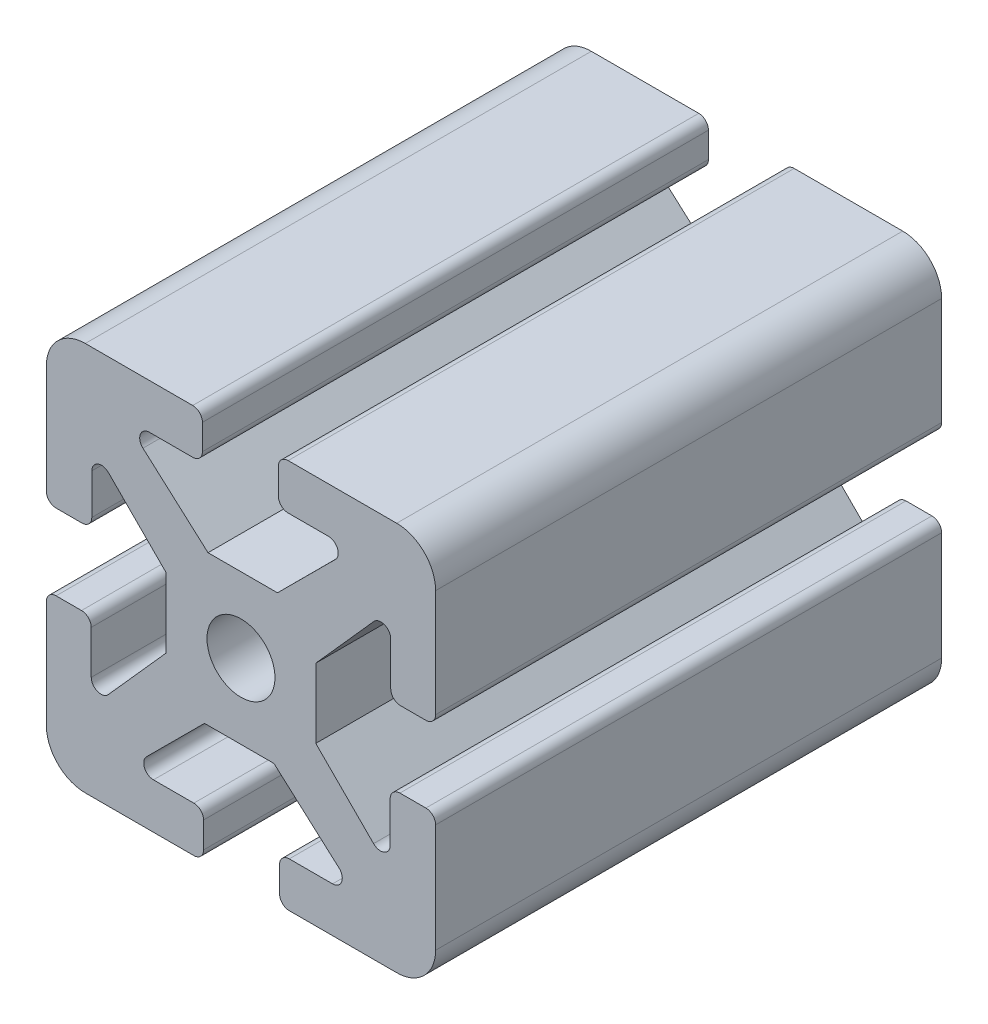
from build123d import *

# Parameters (mm, degrees)
SKETCH2_R           = 3.492543695
BOSS_EXTRUDE1_DEPTH = 52


with BuildPart() as part:
    # Sketch2 → Boss-Extrude1 (new body)
    with BuildSketch(Plane.XY):
        with BuildLine():
            Line((19.48831917, 27.684671829), (23.749889801, 27.684671829))
            Line((23.749889801, 27.684671829), (29.699681879, 33.624984685))
            ThreePointArc((29.699681879, 33.624984685), (29.917171057, 34.714970099), (28.993139054, 35.332654972))
            Line((28.993139054, 35.332654972), (24.845630957, 35.332654972))
            ThreePointArc((24.845630957, 35.332654972), (24.138524175, 35.625548191), (23.845630957, 36.332654972))
            Line((23.845630957, 36.332654972), (23.845630957, 39))
            ThreePointArc((23.845630957, 39), (24.138524175, 39.707106781), (24.845630957, 40))
            Line((24.845630957, 40), (36, 40))
            ThreePointArc((36, 40), (38.828427125, 38.828427125), (40, 36))
            Line((40, 36), (40, 24.961087436))
            ThreePointArc((40, 24.961087436), (39.707106781, 24.253980655), (39, 23.961087436))
            Line((39, 23.961087436), (36.388269628, 23.961087436))
            ThreePointArc((36.388269628, 23.961087436), (35.681162846, 24.253980655), (35.388269628, 24.961087436))
            Line((35.388269628, 24.961087436), (35.388269628, 29.408620307))
            ThreePointArc((35.388269628, 29.408620307), (34.744223919, 30.343123673), (33.641676542, 30.073901274))
            Line((33.641676542, 30.073901274), (27.684671829, 23.388818206))
            Line((27.684671829, 23.388818206), (27.684671829, 20.51168083))
            Line((27.684671829, 20.51168083), (27.684671829, 16.250110199))
            Line((27.684671829, 16.250110199), (33.624984685, 10.300318121))
            ThreePointArc((33.624984685, 10.300318121), (34.714970099, 10.082828943), (35.332654972, 11.006860946))
            Line((35.332654972, 11.006860946), (35.332654972, 15.154369043))
            ThreePointArc((35.332654972, 15.154369043), (35.625548191, 15.861475825), (36.332654972, 16.154369043))
            Line((36.332654972, 16.154369043), (39, 16.154369043))
            ThreePointArc((39, 16.154369043), (39.707106781, 15.861475825), (40, 15.154369043))
            Line((40, 15.154369043), (40, 4))
            ThreePointArc((40, 4), (38.828427125, 1.171572875), (36, 0))
            Line((36, 0), (24.961087436, 0))
            ThreePointArc((24.961087436, 0), (24.253980655, 0.292893219), (23.961087436, 1))
            Line((23.961087436, 1), (23.961087436, 3.611730372))
            ThreePointArc((23.961087436, 3.611730372), (24.253980655, 4.318837154), (24.961087436, 4.611730372))
            Line((24.961087436, 4.611730372), (29.408620307, 4.611730372))
            ThreePointArc((29.408620307, 4.611730372), (30.343123673, 5.255776081), (30.073901274, 6.358323458))
            Line((30.073901274, 6.358323458), (23.388818206, 12.315328171))
            Line((23.388818206, 12.315328171), (20.51168083, 12.315328171))
            Line((20.51168083, 12.315328171), (16.250110199, 12.315328171))
            Line((16.250110199, 12.315328171), (10.300318121, 6.375015315))
            ThreePointArc((10.300318121, 6.375015315), (10.082828943, 5.285029901), (11.006860946, 4.667345028))
            Line((11.006860946, 4.667345028), (15.154369043, 4.667345028))
            ThreePointArc((15.154369043, 4.667345028), (15.861475825, 4.374451809), (16.154369043, 3.667345028))
            Line((16.154369043, 3.667345028), (16.154369043, 1))
            ThreePointArc((16.154369043, 1), (15.861475825, 0.292893219), (15.154369043, 0))
            Line((15.154369043, 0), (4, 0))
            ThreePointArc((4, 0), (1.171572875, 1.171572875), (0, 4))
            Line((0, 4), (0, 15.038912564))
            ThreePointArc((0, 15.038912564), (0.292893219, 15.746019345), (1, 16.038912564))
            Line((1, 16.038912564), (3.611730372, 16.038912564))
            ThreePointArc((3.611730372, 16.038912564), (4.318837154, 15.746019345), (4.611730372, 15.038912564))
            Line((4.611730372, 15.038912564), (4.611730372, 10.591379693))
            ThreePointArc((4.611730372, 10.591379693), (5.255776081, 9.656876327), (6.358323458, 9.926098726))
            Line((6.358323458, 9.926098726), (12.315328171, 16.611181794))
            Line((12.315328171, 16.611181794), (12.315328171, 19.48831917))
            Line((12.315328171, 19.48831917), (12.315328171, 23.749889801))
            Line((12.315328171, 23.749889801), (6.375015315, 29.699681879))
            ThreePointArc((6.375015315, 29.699681879), (5.285029901, 29.917171057), (4.667345028, 28.993139054))
            Line((4.667345028, 28.993139054), (4.667345028, 24.845630957))
            ThreePointArc((4.667345028, 24.845630957), (4.374451809, 24.138524175), (3.667345028, 23.845630957))
            Line((3.667345028, 23.845630957), (1, 23.845630957))
            ThreePointArc((1, 23.845630957), (0.292893219, 24.138524175), (0, 24.845630957))
            Line((0, 24.845630957), (0, 36))
            ThreePointArc((0, 36), (1.171572875, 38.828427125), (4, 40))
            Line((4, 40), (15.038912564, 40))
            ThreePointArc((15.038912564, 40), (15.746019345, 39.707106781), (16.038912564, 39))
            Line((16.038912564, 39), (16.038912564, 36.388269628))
            ThreePointArc((16.038912564, 36.388269628), (15.746019345, 35.681162846), (15.038912564, 35.388269628))
            Line((15.038912564, 35.388269628), (10.591379693, 35.388269628))
            ThreePointArc((10.591379693, 35.388269628), (9.656876327, 34.744223919), (9.926098726, 33.641676542))
            Line((9.926098726, 33.641676542), (16.611181794, 27.684671829))
            Line((16.611181794, 27.684671829), (19.48831917, 27.684671829))
        make_face()
        with Locations(Location((20, 20, 0), (0, 0, 180))):
            Circle(SKETCH2_R, mode=Mode.SUBTRACT)
    extrude(amount=BOSS_EXTRUDE1_DEPTH)


solid = part.part
